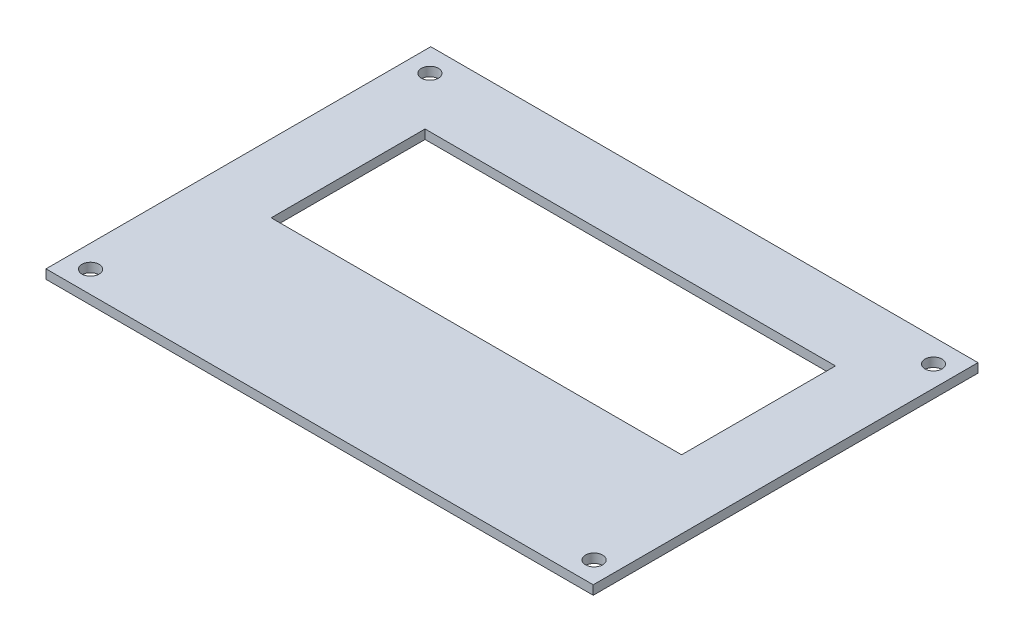
from build123d import *

# Parameters (mm, degrees)
SKETCH1_W               = 96
SKETCH1_H               = 67.5
BOSS_EXTRUDE1_DEPTH     = 1.6
CUT_EXTRUDE1_REACH      = 119.366
SKETCH2_R               = 1.5
CUT_EXTRUDE2_DEPTH      = 118.366136513
CUT_EXTRUDE2_DEPTH_BACK = 118.366136513
SKETCH3_W               = 72
SKETCH3_H               = 27


with BuildPart() as part:
    # Sketch1 → Boss-Extrude1 (new body)
    with BuildSketch(Plane(origin=(0, 0, 0), x_dir=(1, 0, 0), z_dir=(0, 1, 0))):
        with Locations((48, 33.75)):
            Rectangle(SKETCH1_W, SKETCH1_H)
    extrude(amount=BOSS_EXTRUDE1_DEPTH)

    # Sketch2 → Cut-Extrude1 (cut, up to next)
    with BuildSketch(Plane(origin=(0, 1.6, 0), x_dir=(1, 0, 0), z_dir=(0, 1, 0)), mode=Mode.PRIVATE) as cut_extrude1_sk1:
        with Locations(Location((3.96, 3.85, 0), (0, 0, 270))):
            Circle(SKETCH2_R)
    cut_extrude1_tool1 = extrude(cut_extrude1_sk1.sketch, amount=-CUT_EXTRUDE1_REACH, mode=Mode.PRIVATE) & part.part
    # Sketch2 → Cut-Extrude1 (cut, up to next)
    with BuildSketch(Plane(origin=(0, 1.6, 0), x_dir=(1, 0, 0), z_dir=(0, 1, 0)), mode=Mode.PRIVATE) as cut_extrude1_sk2:
        with Locations(Location((92.3, 3.85, 0), (0, 0, 270))):
            Circle(SKETCH2_R)
    cut_extrude1_tool2 = extrude(cut_extrude1_sk2.sketch, amount=-CUT_EXTRUDE1_REACH, mode=Mode.PRIVATE) & part.part
    # Sketch2 → Cut-Extrude1 (cut, up to next)
    with BuildSketch(Plane(origin=(0, 1.6, 0), x_dir=(1, 0, 0), z_dir=(0, 1, 0)), mode=Mode.PRIVATE) as cut_extrude1_sk3:
        with Locations(Location((3.96, 63.39, 0), (0, 0, 270))):
            Circle(SKETCH2_R)
    cut_extrude1_tool3 = extrude(cut_extrude1_sk3.sketch, amount=-CUT_EXTRUDE1_REACH, mode=Mode.PRIVATE) & part.part
    # Sketch2 → Cut-Extrude1 (cut, up to next)
    with BuildSketch(Plane(origin=(0, 1.6, 0), x_dir=(1, 0, 0), z_dir=(0, 1, 0)), mode=Mode.PRIVATE) as cut_extrude1_sk4:
        with Locations(Location((92.3, 63.39, 0), (0, 0, 270))):
            Circle(SKETCH2_R)
    cut_extrude1_tool4 = extrude(cut_extrude1_sk4.sketch, amount=-CUT_EXTRUDE1_REACH, mode=Mode.PRIVATE) & part.part
    add(cut_extrude1_tool1.solids().sort_by_distance((3.96, 1.6, -3.85))[0], mode=Mode.SUBTRACT)
    add(cut_extrude1_tool2.solids().sort_by_distance((92.3, 1.6, -3.85))[0], mode=Mode.SUBTRACT)
    add(cut_extrude1_tool3.solids().sort_by_distance((3.96, 1.6, -63.39))[0], mode=Mode.SUBTRACT)
    add(cut_extrude1_tool4.solids().sort_by_distance((92.3, 1.6, -63.39))[0], mode=Mode.SUBTRACT)

    # Sketch3 → Cut-Extrude2 (cut, two sides: drawn at the far end of the back side and taken through both)
    with BuildSketch(Plane(origin=(0, 1.6, 0), x_dir=(1, 0, 0), z_dir=(0, 1, 0)).offset(-CUT_EXTRUDE2_DEPTH_BACK)):
        with Locations((48, 41)):
            Rectangle(SKETCH3_W, SKETCH3_H)
    extrude(amount=CUT_EXTRUDE2_DEPTH + CUT_EXTRUDE2_DEPTH_BACK, mode=Mode.SUBTRACT)


solid = part.part
